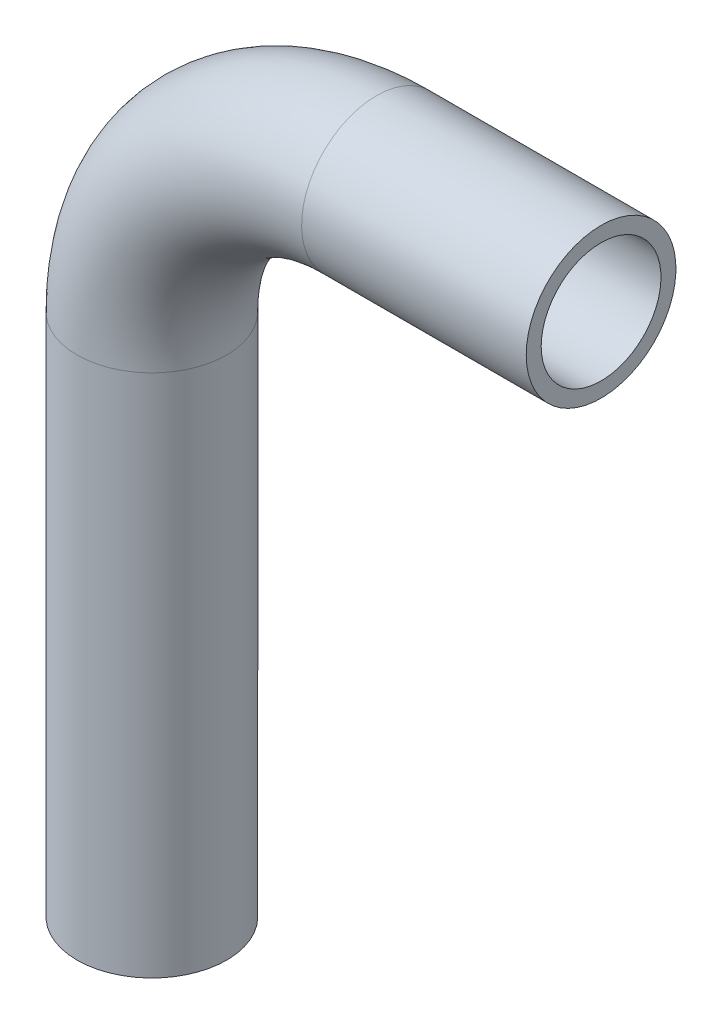
from build123d import *

# Parameters (mm, degrees)
SKETCH1_R   = 12.7
SKETCH1_R_2 = 10.16


with BuildPart() as part:
    # Sweep1: sweep along a path in Sketch2
    with BuildLine(Plane.XY) as sweep1_path:
        Line((0, 0), (0, 88.9))
        ThreePointArc((0, 88.9), (11.159231637, 115.840768363), (38.1, 127))
        Line((38.1, 127), (76.2, 127))
    # Sketch1 → Sweep1 (sweep)
    with BuildSketch(Plane(origin=(0, 0, 0), x_dir=(1, 0, 0), z_dir=(0, 1, 0))):
        Circle(SKETCH1_R)
        Circle(SKETCH1_R_2, mode=Mode.SUBTRACT)
    sweep(path=sweep1_path.line)


solid = part.part
